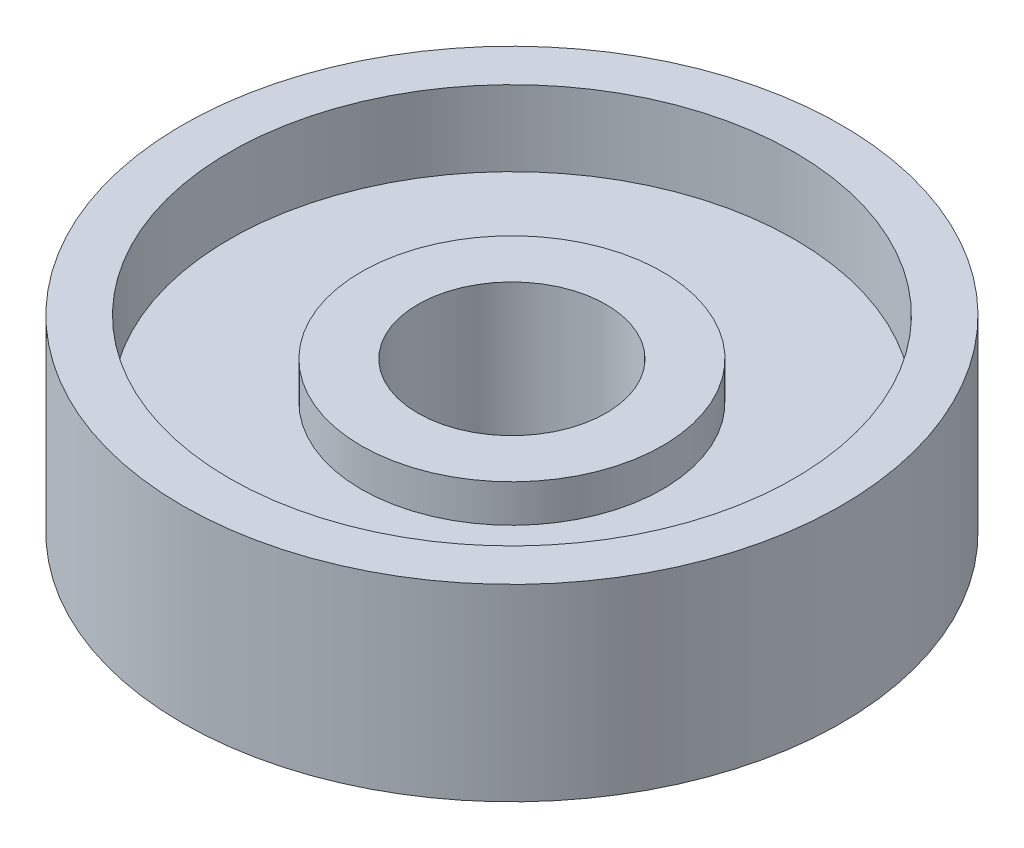
from build123d import *

# Parameters (mm, degrees)
SKETCH3_R           = 11.1125
SKETCH3_R_2         = 3.175
BOSS_EXTRUDE1_DEPTH = 6.35
SKETCH4_R           = 9.525
CUT_EXTRUDE1_DEPTH  = 2.54
SKETCH5_R           = 5.08
SKETCH5_R_2         = 3.175
BOSS_EXTRUDE2_DEPTH = 1.27


with BuildPart() as part:
    # Sketch3 → Boss-Extrude1 (new body)
    with BuildSketch(Plane(origin=(0, 0, 0), x_dir=(1, 0, 0), z_dir=(0, 1, 0))):
        with Locations(Location((0, 0, 0), (0, 0, 270))):
            Circle(SKETCH3_R)
        with Locations(Location((0, 0, 0), (0, 0, 270))):
            Circle(SKETCH3_R_2, mode=Mode.SUBTRACT)
    extrude(amount=BOSS_EXTRUDE1_DEPTH)

    # Sketch4 → Cut-Extrude1 (cut)
    with BuildSketch(Plane(origin=(0, 6.35, 0), x_dir=(1, 0, 0), z_dir=(0, 1, 0))):
        with Locations(Location((0, 0, 0), (0, 0, 270))):
            Circle(SKETCH4_R)
    extrude(amount=-CUT_EXTRUDE1_DEPTH, mode=Mode.SUBTRACT)

    # Sketch5 → Boss-Extrude2 (add)
    with BuildSketch(Plane(origin=(0, 3.81, 0), x_dir=(1, 0, 0), z_dir=(0, 1, 0))):
        with Locations(Location((0, 0, 0), (0, 0, 270))):
            Circle(SKETCH5_R)
        with Locations(Location((0, 0, 0), (0, 0, 270))):
            Circle(SKETCH5_R_2, mode=Mode.SUBTRACT)
    extrude(amount=BOSS_EXTRUDE2_DEPTH)


solid = part.part
